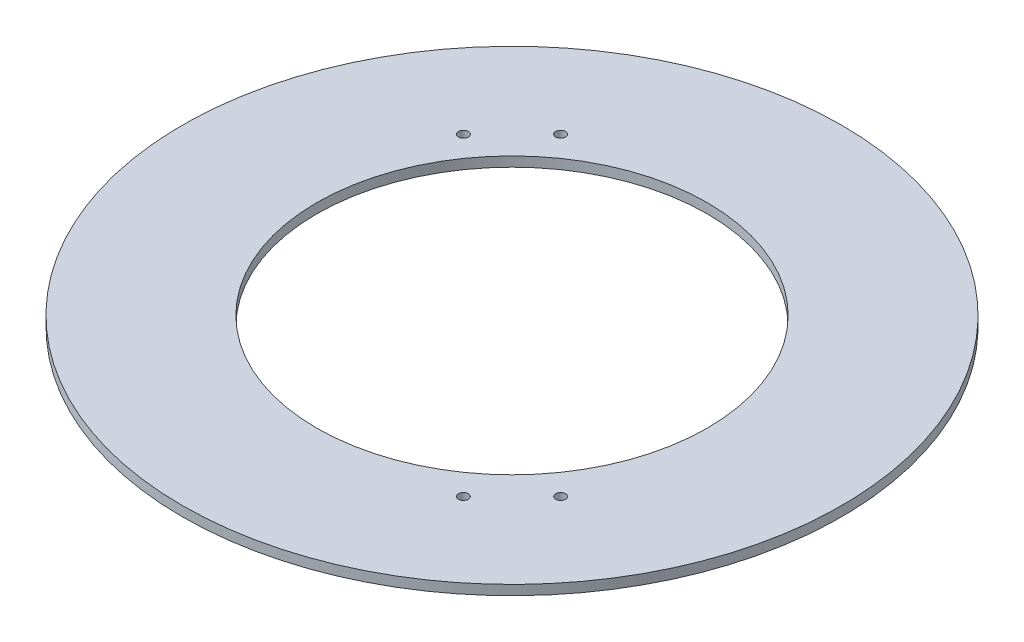
from build123d import *

# Parameters (mm, degrees)
SKETCH2_R           = 135
SKETCH2_R_2         = 80
SKETCH2_R_3         = 2
BOSS_EXTRUDE1_DEPTH = 4


with BuildPart() as part:
    # Sketch2 → Boss-Extrude1 (new body)
    with BuildSketch(Plane(origin=(0, 0, 0), x_dir=(1, 0, 0), z_dir=(0, 1, 0))):
        with Locations(Location((0, 0, 0), (0, 0, 270))):
            Circle(SKETCH2_R)
        with Locations(Location((0, 0, 0), (0, 0, 270))):
            Circle(SKETCH2_R_2, mode=Mode.SUBTRACT)
        with Locations(Location((-74.207321152, 54.302265261, 0), (0, 0, 270))):
            Circle(SKETCH2_R_3, mode=Mode.SUBTRACT)
        with Locations(Location((-54.302265261, 74.207321152, 0), (0, 0, 90))):
            Circle(SKETCH2_R_3, mode=Mode.SUBTRACT)
        with Locations(Location((54.302265261, -74.207321152, 0), (0, 0, 90))):
            Circle(SKETCH2_R_3, mode=Mode.SUBTRACT)
        with Locations(Location((74.207321152, -54.302265261, 0), (0, 0, 270))):
            Circle(SKETCH2_R_3, mode=Mode.SUBTRACT)
    extrude(amount=BOSS_EXTRUDE1_DEPTH)


solid = part.part
